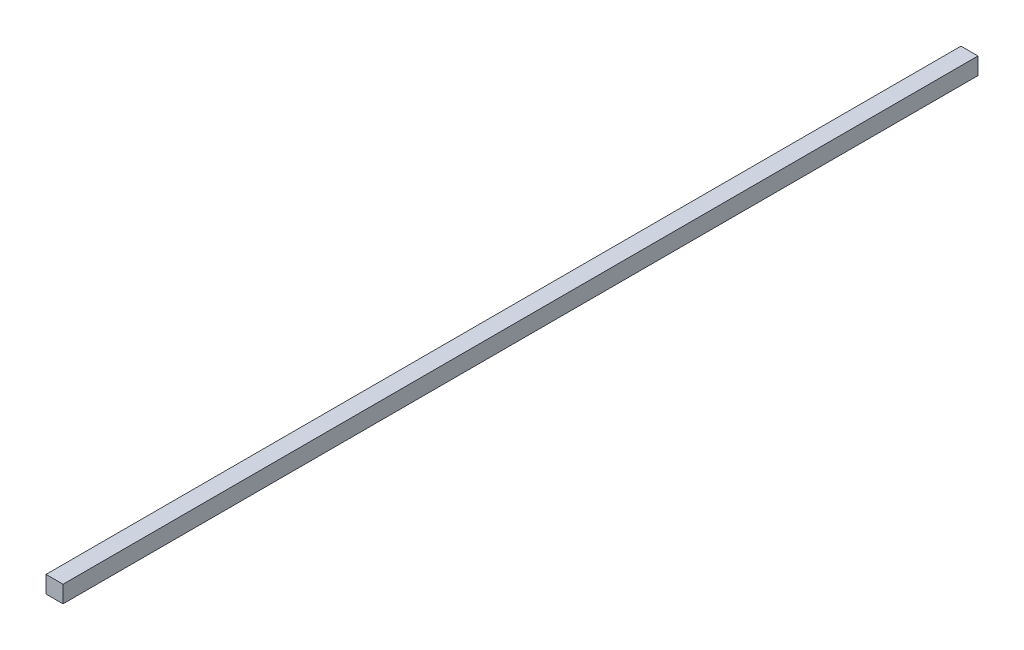
from build123d import *

# Parameters (mm, degrees)
SKETCH3_W           = 1.767766952
SKETCH3_H           = 1.767766952
BOSS_EXTRUDE1_DEPTH = 95


with BuildPart() as part:
    # Sketch3 → Boss-Extrude1 (new body)
    with BuildSketch(Plane.XY):
        Rectangle(SKETCH3_W, SKETCH3_H)
    extrude(amount=BOSS_EXTRUDE1_DEPTH)


solid = part.part
